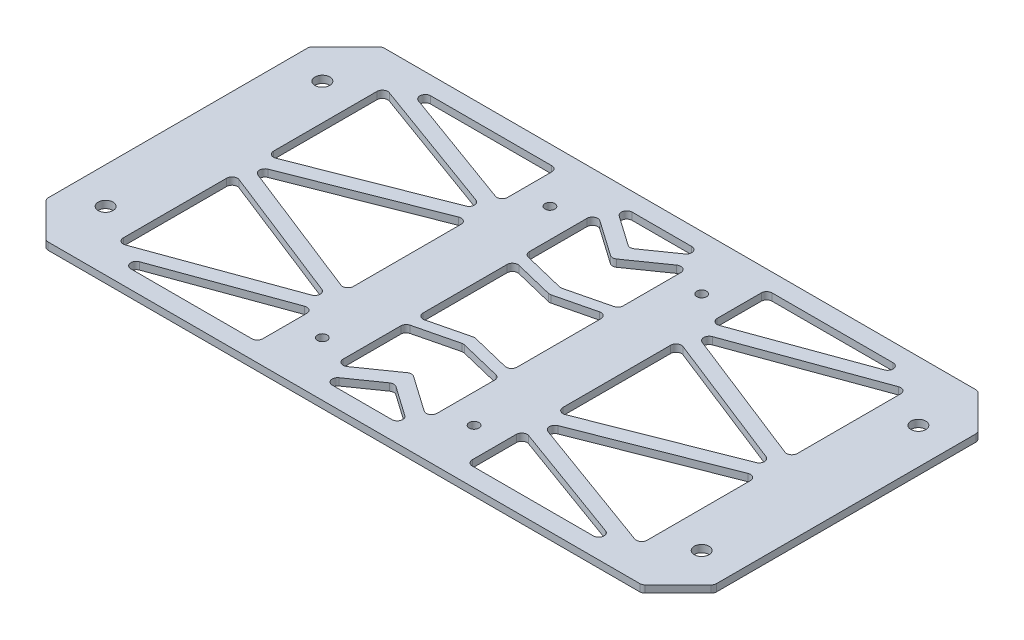
from build123d import *

# Parameters (mm, degrees)
SKETCH_1_W           = 185
SKETCH_1_H           = 93
SKETCH_1_R           = 1.35
EXTRUDE_1_DEPTH      = 2
SKETCH_2_R           = 2.05
CUT_EXTRUDE_1_DEPTH  = 20
CHAMFER_1_SIZE       = 10
FILLET_1_R           = 1.5
CUT_EXTRUDE_10_DEPTH = 20
CUT_EXTRUDE_11_DEPTH = 20
FILLET_2_R           = 1.5


with BuildPart() as part:
    # 草图1 → 凸台-拉伸1 (new body)
    with BuildSketch(Plane(origin=(0, 0, 0), x_dir=(1, 0, 0), z_dir=(0, 1, 0))):
        Rectangle(SKETCH_1_W, SKETCH_1_H)
        with Locations(Location((-21, 31.5, 0), (0, 0, 270))):
            Circle(SKETCH_1_R, mode=Mode.SUBTRACT)
        with Locations(Location((-21, -31.5, 0), (0, 0, 270))):
            Circle(SKETCH_1_R, mode=Mode.SUBTRACT)
        with Locations(Location((21, -31.5, 0), (0, 0, 270))):
            Circle(SKETCH_1_R, mode=Mode.SUBTRACT)
        with Locations(Location((21, 31.5, 0), (0, 0, 270))):
            Circle(SKETCH_1_R, mode=Mode.SUBTRACT)
    extrude(amount=EXTRUDE_1_DEPTH)

    # 草图2 → 切除-拉伸1 (cut)
    with BuildSketch(Plane(origin=(0, 2, 0), x_dir=(1, 0, 0), z_dir=(0, 1, 0))):
        with Locations(Location((-82.5, 30, 0), (0, 0, 270))):
            Circle(SKETCH_2_R)
        with Locations(Location((82.5, 30, 0), (0, 0, 270))):
            Circle(SKETCH_2_R)
        with Locations(Location((82.5, -30, 0), (0, 0, 270))):
            Circle(SKETCH_2_R)
        with Locations(Location((-82.5, -30, 0), (0, 0, 270))):
            Circle(SKETCH_2_R)
    extrude(amount=-CUT_EXTRUDE_1_DEPTH, mode=Mode.SUBTRACT)

    # 倒角1
    chamfer_1_edges = [part.edges().sort_by_distance(p)[0] for p in [
        (-92.5, 1, -46.5),
        (92.5, 1, -46.5),
        (92.5, 1, 46.5),
        (-92.5, 1, 46.5),
    ]]
    chamfer(chamfer_1_edges, length=CHAMFER_1_SIZE)

    # 圆角1
    fillet_1_edges = [part.edges().sort_by_distance(p)[0] for p in [
        (-82.5, 1, -46.5),
        (82.5, 1, -46.5),
        (92.5, 1, 36.5),
        (92.5, 1, -36.5),
        (-82.5, 1, 46.5),
        (82.5, 1, 46.5),
        (-92.5, 1, -36.5),
        (-92.5, 1, 36.5),
    ]]
    fillet(fillet_1_edges, radius=FILLET_1_R)

    # 草图3 → 切除-拉伸10 (cut)
    with BuildSketch(Plane(origin=(0, 2, 0), x_dir=(1, 0, 0), z_dir=(0, 1, 0))):
        Polygon((-29, 41.5), (-72.5, 41.5), (-29, 25.667294809), align=None)
        Polygon((-29, 21.41058372), (-72.5, 37.24328891), (-72.5, 4.298373792), align=None)
        Polygon((-29, 17.112209927), (-72.5, 0), (-29, -17.112209927), align=None)
        Polygon((-29, -21.41058372), (-72.5, -4.298373792), (-72.5, -37.24328891), align=None)
        Polygon((-29, -25.667294809), (-72.5, -41.5), (-29, -41.5), align=None)
        Polygon((29, -41.5), (72.5, -41.5), (29, -25.667294809), align=None)
        Polygon((29, -21.41058372), (72.5, -37.24328891), (72.5, -4.298373792), align=None)
        Polygon((29, 17.112209927), (29, -17.112209927), (72.5, 0), align=None)
        Polygon((29, 21.41058372), (72.5, 4.298373792), (72.5, 37.24328891), align=None)
        Polygon((29, 41.5), (29, 25.667294809), (72.5, 41.5), align=None)
    extrude(amount=-CUT_EXTRUDE_10_DEPTH, mode=Mode.SUBTRACT)

    # 草图4 → 切除-拉伸11 (cut)
    with BuildSketch(Plane(origin=(0, 2, 0), x_dir=(1, 0, 0), z_dir=(0, 1, 0))):
        Polygon((-13, 41.5), (0, 32.397302003), (13, 41.5), align=None)
        Polygon((0, 27.514203648), (-13, 36.616901645), (-13, 16.616901645), (0, 24.514203648), (13, 16.616901645), (13, 36.616901645), align=None)
        Polygon((-13, 16.616901645), (0, 13.442564884), (13, 16.616901645), (0, 24.514203648), align=None)
        Polygon((0, 10.354424059), (-13, 13.52876082), (-13, 0), (0, 7.354424059), (13, 0), (13, 13.52876082), align=None)
        Polygon((-13, 0), (0, 7.354424059), (13, 0), (0, -7.354424059), align=None)
        Polygon((0, -7.354424059), (-13, 0), (-13, -13.52876082), (0, -10.354424059), (13, -13.52876082), (13, 0), align=None)
        Polygon((0, -13.442564884), (13, -16.616901645), (0, -24.514203648), (-13, -16.616901645), align=None)
        Polygon((0, -24.514203648), (-13, -16.616901645), (-13, -36.616901645), (0, -27.514203648), (13, -36.616901645), (13, -16.616901645), align=None)
        Polygon((0, -32.397302003), (13, -41.5), (-13, -41.5), align=None)
    extrude(amount=-CUT_EXTRUDE_11_DEPTH, mode=Mode.SUBTRACT)

    # 圆角2
    fillet_2_edges = [part.edges().sort_by_distance(p)[0] for p in [
        (-72.5, 1, 37.24328891),
        (-72.5, 1, 4.298373792),
        (-29, 1, 21.41058372),
        (-72.5, 1, 41.5),
        (-29, 1, 25.667294809),
        (-29, 1, 41.5),
        (-29, 1, -21.41058372),
        (-72.5, 1, -4.298373792),
        (-72.5, 1, -37.24328891),
        (-72.5, 1, 0),
        (-29, 1, -17.112209927),
        (-29, 1, 17.112209927),
        (29, 1, -17.112209927),
        (72.5, 1, 0),
        (29, 1, 17.112209927),
        (72.5, 1, -37.24328891),
        (72.5, 1, -4.298373792),
        (29, 1, -21.41058372),
        (72.5, 1, 41.5),
        (29, 1, 41.5),
        (29, 1, 25.667294809),
        (72.5, 1, 4.298373792),
        (72.5, 1, 37.24328891),
        (29, 1, 21.41058372),
        (72.5, 1, -41.5),
        (29, 1, -25.667294809),
        (29, 1, -41.5),
        (-72.5, 1, -41.5),
        (-29, 1, -41.5),
        (-29, 1, -25.667294809),
        (-13, 1, 13.52876082),
        (-13, 1, -13.52876082),
        (0, 1, -10.354424059),
        (13, 1, -13.52876082),
        (13, 1, 13.52876082),
        (0, 1, 10.354424059),
        (-13, 1, -16.616901645),
        (-13, 1, -36.616901645),
        (0, 1, -27.514203648),
        (13, 1, -36.616901645),
        (13, 1, -16.616901645),
        (0, 1, -13.442564884),
        (0, 1, 32.397302003),
        (13, 1, 41.5),
        (-13, 1, 41.5),
        (-13, 1, 16.616901645),
        (0, 1, 13.442564884),
        (13, 1, 16.616901645),
        (13, 1, 36.616901645),
        (0, 1, 27.514203648),
        (-13, 1, 36.616901645),
        (0, 1, -32.397302003),
        (-13, 1, -41.5),
        (13, 1, -41.5),
    ]]
    fillet(fillet_2_edges, radius=FILLET_2_R)


solid = part.part
